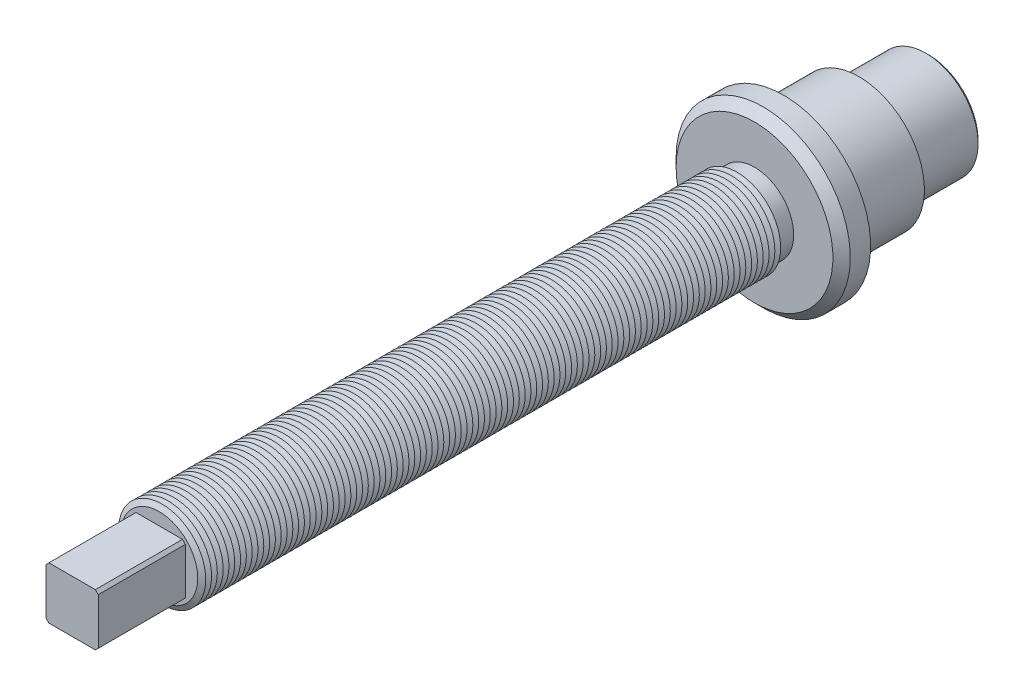
from build123d import *

# Parameters (mm, degrees)
SKETCH_1_R                = 15
EXTRUDE_1687_DEPTH        = 230
PATTERN_LINEAR_2071_COUNT = 116
PATTERN_LINEAR_2071_PITCH = 2
SKETCH_3_R                = 13.5
EXTRUDE_1_DEPTH           = 5
SKETCH_4_R                = 30
EXTRUDE_2_DEPTH           = 10
SKETCH_5_R                = 22.5
EXTRUDE_3_DEPTH           = 50
CHAMFER_1_SIZE            = 3
SKETCH_6_R                = 16.5
SKETCH_6_W                = 18
SKETCH_6_H                = 18
CUT_EXTRUDE_1_DEPTH       = 30
CHAMFER_3_SIZE            = 1
CUT_EXTRUDE_START         = -24
SKETCH_8_R                = 22.5
SKETCH_8_R_2              = 18
CUT_EXTRUDE_3_DEPTH       = 24
CHAMFER_5_SIZE            = 1


with BuildPart() as part:
    # 草图1 → Extrude 1687 (new body)
    with BuildSketch(Plane.XY):
        Circle(SKETCH_1_R)
    extrude(amount=-EXTRUDE_1687_DEPTH)

    # 草图2 → Cut-Revolve 2033 (revolve, cut)
    with BuildSketch(Plane(origin=(0, 0, 0), x_dir=(0, 0, -1), z_dir=(1, 0, 0)), mode=Mode.PRIVATE) as cut_revolve_2033_sk:
        Polygon((229.000029334, 15), (230.999970666, 15), (230, 13.268), align=None)
    cut_revolve_2033 = revolve(cut_revolve_2033_sk.sketch.rotate(Axis((0, 0, 103.323831553), (0, 0, -1)), 90), axis=Axis((0, 0, 103.323831553), (0, 0, -1)), mode=Mode.SUBTRACT)

    # Pattern Linear 2071: Cut-Revolve 2033 ×116
    with Locations(*[(0, 0, i * PATTERN_LINEAR_2071_PITCH) for i in range(1, PATTERN_LINEAR_2071_COUNT)]):
        add(cut_revolve_2033, mode=Mode.SUBTRACT)

    # 草图3 → 凸台-拉伸1 (add)
    with BuildSketch(Plane(origin=(0, 0, -230), x_dir=(-1, 0, 0), z_dir=(0, 0, -1))):
        Circle(SKETCH_3_R)
    extrude(amount=EXTRUDE_1_DEPTH)

    # 草图4 → 凸台-拉伸2 (add)
    with BuildSketch(Plane(origin=(0, 0, -235), x_dir=(-1, 0, 0), z_dir=(0, 0, -1))):
        Circle(SKETCH_4_R)
    extrude(amount=EXTRUDE_2_DEPTH)

    # 草图5 → 凸台-拉伸3 (add)
    with BuildSketch(Plane(origin=(0, 0, -245), x_dir=(-1, 0, 0), z_dir=(0, 0, -1))):
        Circle(SKETCH_5_R)
    extrude(amount=EXTRUDE_3_DEPTH)

    # 倒角1
    chamfer_1_edges = [part.edges().sort_by_distance(p)[0] for p in [
        (30, 0, -235),
    ]]
    chamfer(chamfer_1_edges, length=CHAMFER_1_SIZE)

    # 草图6 → 切除-拉伸1 (cut)
    with BuildSketch(Plane.XY):
        Circle(SKETCH_6_R)
        Rectangle(SKETCH_6_W, SKETCH_6_H, mode=Mode.SUBTRACT)
    extrude(amount=-CUT_EXTRUDE_1_DEPTH, mode=Mode.SUBTRACT)

    # 倒角3
    chamfer_3_edges = [part.edges().sort_by_distance(p)[0] for p in [
        (-9, 9, -15),
        (9, 9, -15),
        (9, -9, -15),
        (-9, -9, -15),
    ]]
    chamfer(chamfer_3_edges, length=CHAMFER_3_SIZE)

    # 草图8 → 切除-拉伸3 (cut)
    with BuildSketch(Plane(origin=(0, 0, -295), x_dir=(-1, 0, 0), z_dir=(0, 0, -1)).offset(CUT_EXTRUDE_START)):
        Circle(SKETCH_8_R)
        Circle(SKETCH_8_R_2, mode=Mode.SUBTRACT)
    extrude(amount=CUT_EXTRUDE_3_DEPTH, mode=Mode.SUBTRACT)

    # 倒角5
    chamfer_5_edges = [part.edges().sort_by_distance(p)[0] for p in [
        (18, 0, -295),
    ]]
    chamfer(chamfer_5_edges, length=CHAMFER_5_SIZE)


solid = part.part
